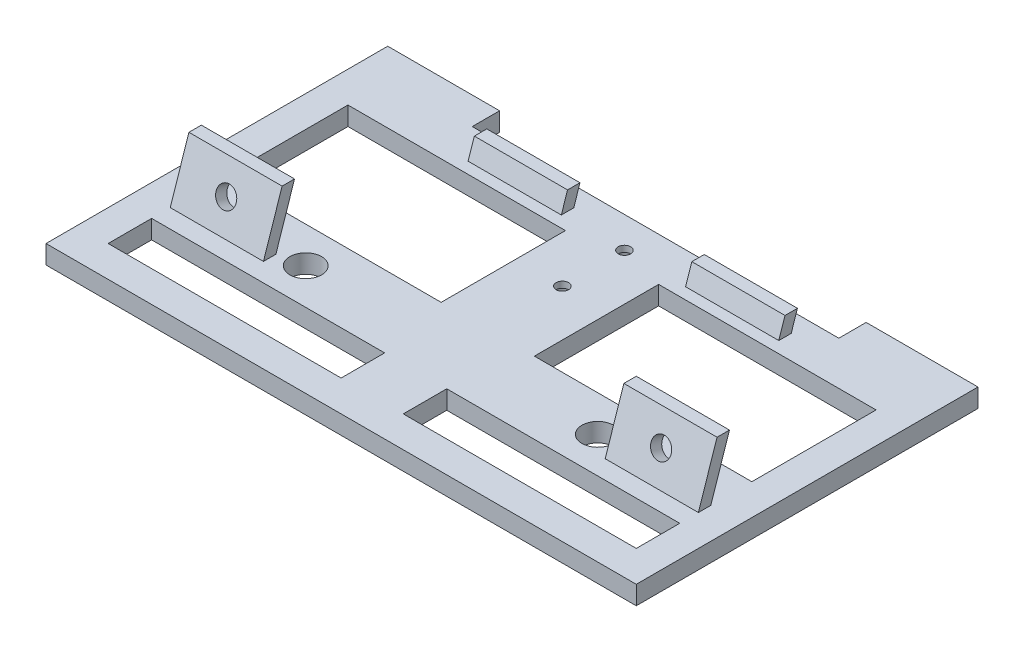
from build123d import *

# Parameters (mm, degrees)
CROQUIS1_R                = 1
CROQUIS1_W                = 35
CROQUIS1_H                = 20
CROQUIS1_W_2              = 37.5
CROQUIS1_H_2              = 7
SALIENTE_EXTRUIR1_DEPTH   = 3
CUT_EXTRUDE1_DEPTH        = 59
SKETCH3_R                 = 2.75
CUT_EXTRUDE2_DEPTH        = 2
CORTAR_EXTRUIR1_REACH     = 58.617
CROQUIS2_R                = 2.55
SALIENTE_EXTRUIR6_DEPTH   = 95
SALIENTE_EXTRUIR6_2_DEPTH = 95
CROQUIS4_W                = 20
CROQUIS4_H                = 3.002956163
CROQUIS4_W_2              = 22.5
CROQUIS4_H_2              = 3
CORTAR_EXTRUIR2_DEPTH     = 95
CROQUIS5_W                = 5
CROQUIS5_H                = 9
CROQUIS5_W_2              = 55
CORTAR_EXTRUIR3_DEPTH     = 30
CROQUIS6_R                = 1.625
CORTAR_EXTRUIR4_DEPTH     = 1.897367


with BuildPart() as part:
    # Croquis1 → Saliente-Extruir1 (new body)
    with BuildSketch(Plane(origin=(0, 0, 0), x_dir=(1, 0, 0), z_dir=(0, 1, 0))):
        Polygon((-47.5, -24.3375), (47.5, -24.3375), (47.5, 30.6625), (29.5, 30.6625), (29.5, 26.2625), (-29.5, 26.2625), (-29.5, 30.6625), (-47.5, 30.6625), align=None)
        with Locations(Location((0, 21.2625, 0), (0, 0, 270))):
            Circle(CROQUIS1_R, mode=Mode.SUBTRACT)
        with Locations(Location((0, 11.2625, 0), (0, 0, 270))):
            Circle(CROQUIS1_R, mode=Mode.SUBTRACT)
        with Locations((-25, 9.2625)):
            Rectangle(CROQUIS1_W, CROQUIS1_H, mode=Mode.SUBTRACT)
        with Locations((25, 9.2625)):
            Rectangle(CROQUIS1_W, CROQUIS1_H, mode=Mode.SUBTRACT)
        with Locations((-23.75, -15.8375)):
            Rectangle(CROQUIS1_W_2, CROQUIS1_H_2, mode=Mode.SUBTRACT)
        with Locations((23.75, -15.8375)):
            Rectangle(CROQUIS1_W_2, CROQUIS1_H_2, mode=Mode.SUBTRACT)
    extrude(amount=SALIENTE_EXTRUIR1_DEPTH)

    # Sketch2 → Cut-Extrude1 (cut)
    with BuildSketch(Plane.ZY.offset(-29.5)):
        Polygon((-26.2625, 3), (-25.2625, 0), (-26.2625, 0), align=None)
    extrude(amount=CUT_EXTRUDE1_DEPTH, mode=Mode.SUBTRACT)

    # Sketch3 → Cut-Extrude2 (cut)
    with BuildSketch(Plane.XZ):
        with Locations(Location((0, -11.2625, 0), (0, 0, 270))):
            Circle(SKETCH3_R)
        with Locations(Location((0, -21.2625, 0), (0, 0, 270))):
            Circle(SKETCH3_R)
    extrude(amount=-CUT_EXTRUDE2_DEPTH, mode=Mode.SUBTRACT)

    # Croquis2 → Cortar-Extruir1 (cut, up to next)
    with BuildSketch(Plane(origin=(0, 3, 0), x_dir=(1, 0, 0), z_dir=(0, 1, 0)), mode=Mode.PRIVATE) as cortar_extruir1_sk1:
        with Locations(Location((-23.5, -6.5375, 0), (0, 0, 270))):
            Circle(CROQUIS2_R)
    cortar_extruir1_tool1 = extrude(cortar_extruir1_sk1.sketch, amount=-CORTAR_EXTRUIR1_REACH, mode=Mode.PRIVATE) & part.part
    # Croquis2 → Cortar-Extruir1 (cut, up to next)
    with BuildSketch(Plane(origin=(0, 3, 0), x_dir=(1, 0, 0), z_dir=(0, 1, 0)), mode=Mode.PRIVATE) as cortar_extruir1_sk2:
        with Locations(Location((23.5, -6.5375, 0), (0, 0, 270))):
            Circle(CROQUIS2_R)
    cortar_extruir1_tool2 = extrude(cortar_extruir1_sk2.sketch, amount=-CORTAR_EXTRUIR1_REACH, mode=Mode.PRIVATE) & part.part
    add(cortar_extruir1_tool1.solids().sort_by_distance((-23.5, 3, 6.5375))[0], mode=Mode.SUBTRACT)
    add(cortar_extruir1_tool2.solids().sort_by_distance((23.5, 3, 6.5375))[0], mode=Mode.SUBTRACT)


with BuildPart() as body_2:
    # Croquis3 → Saliente-Extruir6 (new body)
    with BuildSketch(Plane(origin=(47.5, 0, 0), x_dir=(0, 0, -1), z_dir=(1, 0, 0))):
        Polygon((-9.3375, 3), (-6.3375, 12), (-4.3375, 12), (-7.3375, 3), align=None)
    extrude(amount=-SALIENTE_EXTRUIR6_DEPTH)

    # Croquis5 → Cortar-Extruir3 (cut)
    with BuildSketch(Plane.XY.offset(24.3375)):
        with Locations((45, 7.5)):
            Rectangle(CROQUIS5_W, CROQUIS5_H)
        with Locations((-45, 7.5)):
            Rectangle(CROQUIS5_W, CROQUIS5_H)
        with Locations((0, 7.5)):
            Rectangle(CROQUIS5_W_2, CROQUIS5_H)
    extrude(amount=-CORTAR_EXTRUIR3_DEPTH, mode=Mode.SUBTRACT)


with BuildPart() as body_3:
    # Croquis3 → Saliente-Extruir6 2 (new body)
    with BuildSketch(Plane(origin=(47.5, 0, 0), x_dir=(0, 0, -1), z_dir=(1, 0, 0))):
        Polygon((21.1025, 3), (22.1025, 6), (24.1025, 6), (23.1025, 3), align=None)
    extrude(amount=-SALIENTE_EXTRUIR6_2_DEPTH)

    # Croquis4 → Cortar-Extruir2 (cut)
    with BuildSketch(Plane(origin=(0, 0, -30.6625), x_dir=(-1, 0, 0), z_dir=(0, 0, -1))):
        with Locations((0, 4.501478082)):
            Rectangle(CROQUIS4_W, CROQUIS4_H)
        with Locations((-36.25, 4.5)):
            Rectangle(CROQUIS4_W_2, CROQUIS4_H_2)
        with Locations((36.25, 4.5)):
            Rectangle(CROQUIS4_W_2, CROQUIS4_H_2)
    extrude(amount=-CORTAR_EXTRUIR2_DEPTH, mode=Mode.SUBTRACT)


with BuildPart() as cortar_extruir2_piece_1:
    # of the separate pieces the step leaves, piece 1, a body of its own (cortar_extruir2_pieces)
    add(body_3.part.solids().sort_by_distance((-10, 6, -22.1025))[0])


with BuildPart() as cortar_extruir2_piece_2:
    # of the separate pieces the step leaves, piece 2, a body of its own (cortar_extruir2_pieces)
    add(body_3.part.solids().sort_by_distance((25, 3, -21.1025))[0])


with BuildPart() as cortar_extruir3_piece_1:
    # of the separate pieces the step leaves, piece 1, a body of its own (cortar_extruir3_pieces)
    add(body_2.part.solids().sort_by_distance((42.5, 12, 6.3375))[0])


with BuildPart() as cortar_extruir3_piece_2:
    # of the separate pieces the step leaves, piece 2, a body of its own (cortar_extruir3_pieces)
    add(body_2.part.solids().sort_by_distance((-27.5, 12, 6.3375))[0])


with BuildPart() as cortar_extruir4_tool:
    # Croquis6 → Cortar-Extruir4 (new body)
    with BuildSketch(Plane(origin=(0, 3.10125, 9.30375), x_dir=(1, 0, 0), z_dir=(0, 0.3162277660168377, 0.948683298050514))):
        with Locations(Location((-35, 4.636689619, 0), (0, 0, 270))):
            Circle(CROQUIS6_R)
        with Locations(Location((35, 4.636689619, 0), (0, 0, 90))):
            Circle(CROQUIS6_R)
    extrude(amount=-CORTAR_EXTRUIR4_DEPTH)


with BuildPart() as cortar_extruir3_piece_1_1:
    add(cortar_extruir3_piece_1.part)

    # Cortar-Extruir4: cut by cortar_extruir4_tool
    add(cortar_extruir4_tool.part, mode=Mode.SUBTRACT)


with BuildPart() as cortar_extruir3_piece_2_1:
    add(cortar_extruir3_piece_2.part)

    # Cortar-Extruir4: cut by cortar_extruir4_tool
    add(cortar_extruir4_tool.part, mode=Mode.SUBTRACT)


solid = Compound([part.part, cortar_extruir2_piece_1.part, cortar_extruir2_piece_2.part, cortar_extruir3_piece_1_1.part, cortar_extruir3_piece_2_1.part])
